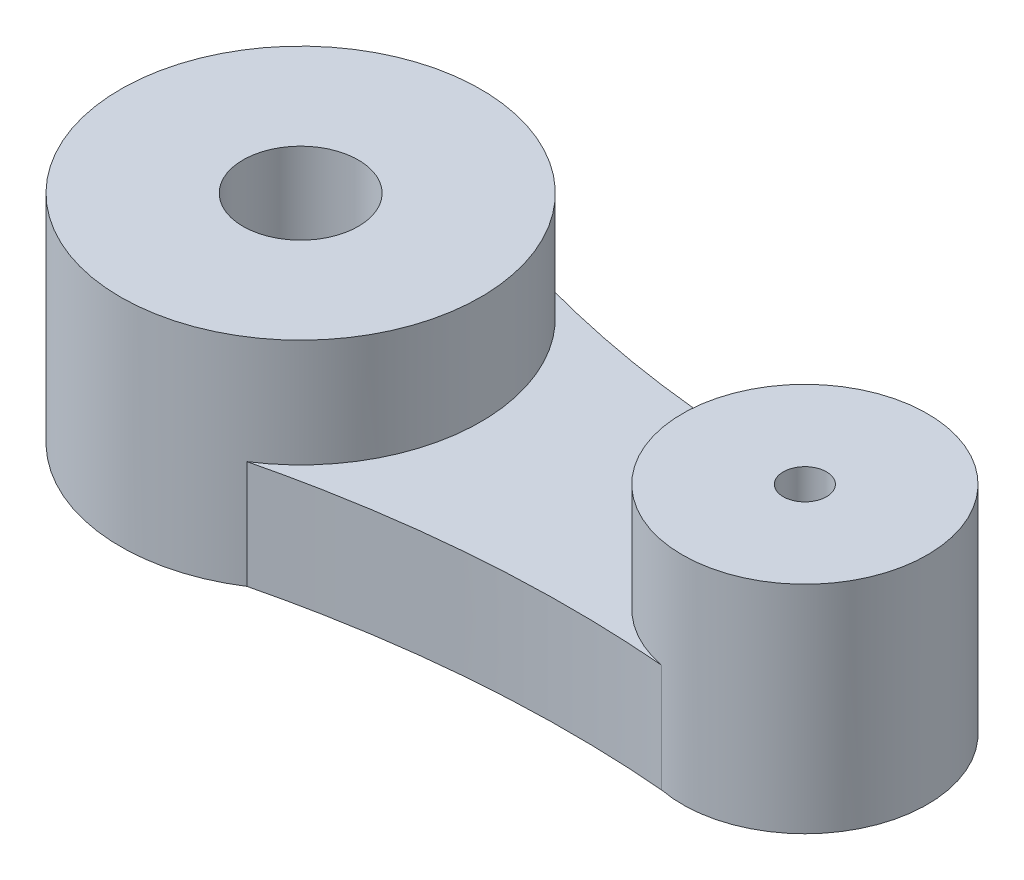
from build123d import *

# Parameters (mm, degrees)
SZKIC1_R                    = 12.5
DODANIE_WYCI_GNI_CIE2_DEPTH = 15
SZKIC3_R                    = 8.5
DODANIE_WYCI_GNI_CIE3_DEPTH = 15
DODANIE_WYCI_GNI_CIE4_DEPTH = 7.5
OTWORY_USTALAJ_CE_8_0MM1_D  = 8
OTWORY_USTALAJ_CE_3_0MM2_D  = 3


with BuildPart() as part:
    # Szkic1 → Dodanie-wyciągnięcie2 (new body)
    with BuildSketch(Plane(origin=(0, 0, 0), x_dir=(1, 0, 0), z_dir=(0, 1, 0))):
        with Locations(Location((0, 0, 0), (0, 0, 270))):
            Circle(SZKIC1_R)
    extrude(amount=DODANIE_WYCI_GNI_CIE2_DEPTH)



with BuildPart() as body_2:
    # Szkic3 → Dodanie-wyciągnięcie3 (new body)
    with BuildSketch(Plane(origin=(0, 0, 0), x_dir=(1, 0, 0), z_dir=(0, 1, 0))):
        with Locations(Location((35, 0, 0), (0, 0, 270))):
            Circle(SZKIC3_R)
    extrude(amount=DODANIE_WYCI_GNI_CIE3_DEPTH)


with BuildPart() as part_1:
    add(part.part)

    add(body_2.part)  # Dodanie-wyciągnięcie4 merges body 2
    # Szkic4 → Dodanie-wyciągnięcie4 (add)
    with BuildSketch(Plane(origin=(0, 0, 0), x_dir=(-1, 0, 0), z_dir=(0, -1, 0))):
        with BuildLine():
            ThreePointArc((-6.778939078, 10.502189533), (-12.5, 0), (-6.778939078, -10.502189533))
            add(Edge.make_bspline(
                [(-6.778939078, -10.502189533), (-20.225507154, -7.239536671), (-33.411274741, -8.350206707)],
                knots=[0, 0, 0, 0.631379274, 0.631379274, 0.631379274], degree=2))
            ThreePointArc((-33.411274741, -8.350206707), (-26.503236916, -0.234557237), (-32.953022418, 8.249841379))
            add(Edge.make_bspline(
                [(-6.778939078, 10.502189533), (-20.078070114, 6.877362512), (-32.953022418, 8.249841379)],
                knots=[0, 0, 0, 0.617827196, 0.617827196, 0.617827196], degree=2))
        make_face()
    extrude(amount=-DODANIE_WYCI_GNI_CIE4_DEPTH)

    # Otwory ustalające Ø8.0mm1 (through all)
    with Locations(Plane(origin=(0, 15, 0), x_dir=(1, 0, 0), z_dir=(0, 1, 0))):
        with Locations((0, 0)):
            Hole(OTWORY_USTALAJ_CE_8_0MM1_D / 2)

    # Otwory ustalające Ø3.0mm2 (through all)
    with Locations(Plane(origin=(0, 15, 0), x_dir=(1, 0, 0), z_dir=(0, 1, 0))):
        with Locations((35, 0)):
            Hole(OTWORY_USTALAJ_CE_3_0MM2_D / 2)


solid = part_1.part
